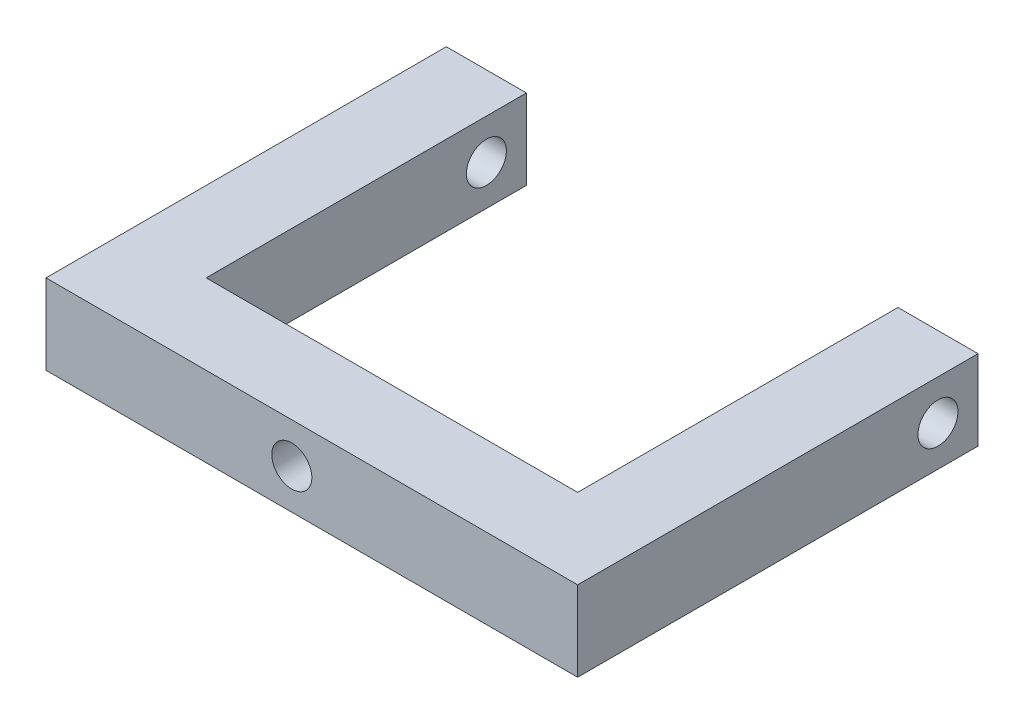
from build123d import *

# Parameters (mm, degrees)
BOSS_EXTRUDE1_DEPTH = 12.7
CUT_EXTRUDE1_REACH  = 108.324
SKETCH2_R           = 3.175
SKETCH3_R           = 3.175
CUT_EXTRUDE2_DEPTH  = 12.7


with BuildPart() as part:
    # Sketch1 → Boss-Extrude1 (new body)
    with BuildSketch(Plane(origin=(0, 0, 0), x_dir=(1, 0, 0), z_dir=(0, 1, 0))):
        Polygon((0, 0), (-84.328, 0), (-84.328, 63.5), (-71.628, 63.5), (-71.628, 12.7), (-12.7, 12.7), (-12.7, 63.5), (0, 63.5), align=None)
    extrude(amount=BOSS_EXTRUDE1_DEPTH)

    # Cut-Extrude1: up to this face of the body (flat: up to its plane)
    cut_extrude1_end = Plane(part.part.faces().sort_by_distance((-84.328, 6.35, -31.75))[0])
    # Sketch2 → Cut-Extrude1 (cut, up to the picked face)
    with BuildSketch(Plane(origin=(0, 0, 0), x_dir=(0, 0, -1), z_dir=(1, 0, 0)), mode=Mode.PRIVATE) as cut_extrude1_sk1:
        with Locations(Location((57.15, 6.35, 0), (0, 0, 180))):
            Circle(SKETCH2_R)
    cut_extrude1_tool1 = split(extrude(cut_extrude1_sk1.sketch, amount=-CUT_EXTRUDE1_REACH, mode=Mode.PRIVATE), bisect_by=cut_extrude1_end, keep=Keep.BOTH, mode=Mode.PRIVATE)
    add(cut_extrude1_tool1.solids().sort_by(Axis((0, 6.35, -57.15), (-1, 0, 0)))[0], mode=Mode.SUBTRACT)

    # Sketch3 → Cut-Extrude2 (cut)
    with BuildSketch(Plane(origin=(0, 0, -12.7), x_dir=(-1, 0, 0), z_dir=(0, 0, -1))):
        with Locations((45.339, 6.35)):
            Circle(SKETCH3_R)
    extrude(amount=-CUT_EXTRUDE2_DEPTH, mode=Mode.SUBTRACT)


solid = part.part
